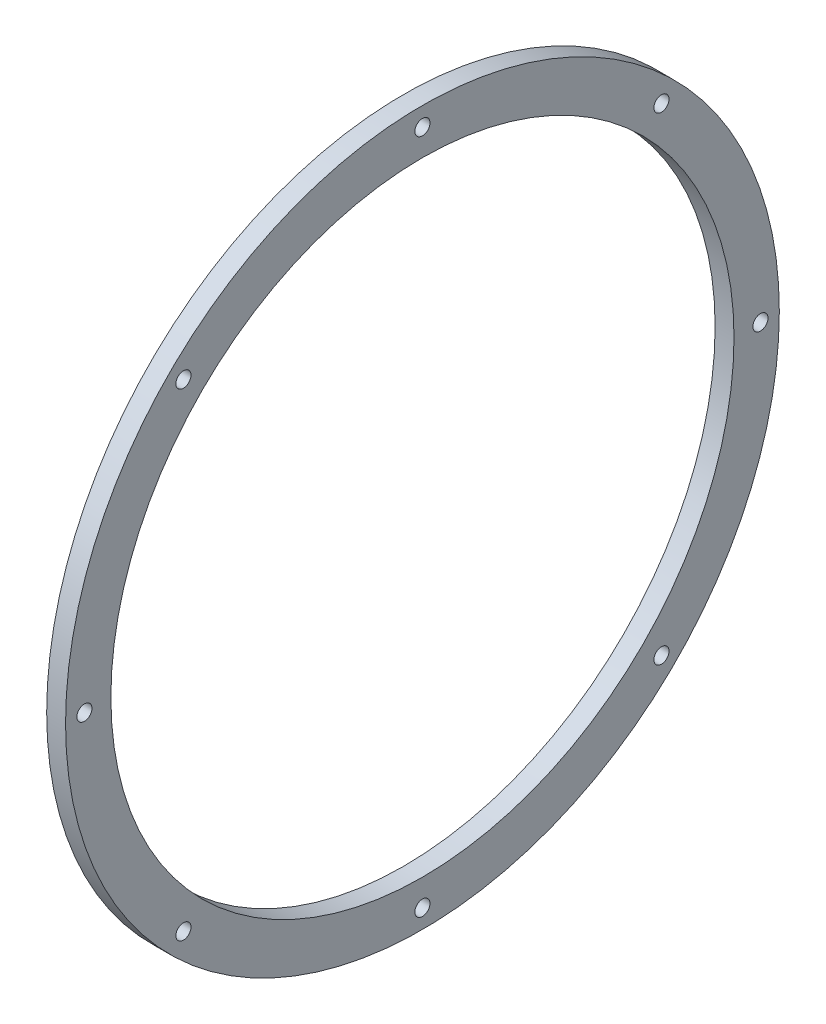
from build123d import *

# Parameters (mm, degrees)
SKETCH1_W          = 5
SKETCH1_H          = 12
SKETCH2_R          = 2
CUT_EXTRUDE1_DEPTH = 30
CIRPATTERN1_COUNT  = 8


with BuildPart() as part:
    # Sketch1 → Revolve1 (revolve)
    with BuildSketch(Plane.XY, mode=Mode.PRIVATE) as revolve1_sk:
        with Locations((-83.5, 88.5)):
            Rectangle(SKETCH1_W, SKETCH1_H)
    revolve(revolve1_sk.sketch.rotate(Axis((-206.017932179, 0, 0), (1, 0, 0)), 90), axis=Axis((-206.017932179, 0, 0), (1, 0, 0)))

    # Sketch2 → Cut-Extrude1 (cut)
    with BuildSketch(Plane.ZY.offset(86)):
        with Locations((0, 89.5)):
            Circle(SKETCH2_R)
    cut_extrude1 = extrude(amount=-CUT_EXTRUDE1_DEPTH, mode=Mode.SUBTRACT)

    # CirPattern1: Cut-Extrude1 ×8 about axis
    cirpattern1_axis = Axis((0, 0, 0), (1, 0, 0))
    for i in range(1, CIRPATTERN1_COUNT):
        add(cut_extrude1.rotate(cirpattern1_axis, i * 360 / CIRPATTERN1_COUNT), mode=Mode.SUBTRACT)


solid = part.part
